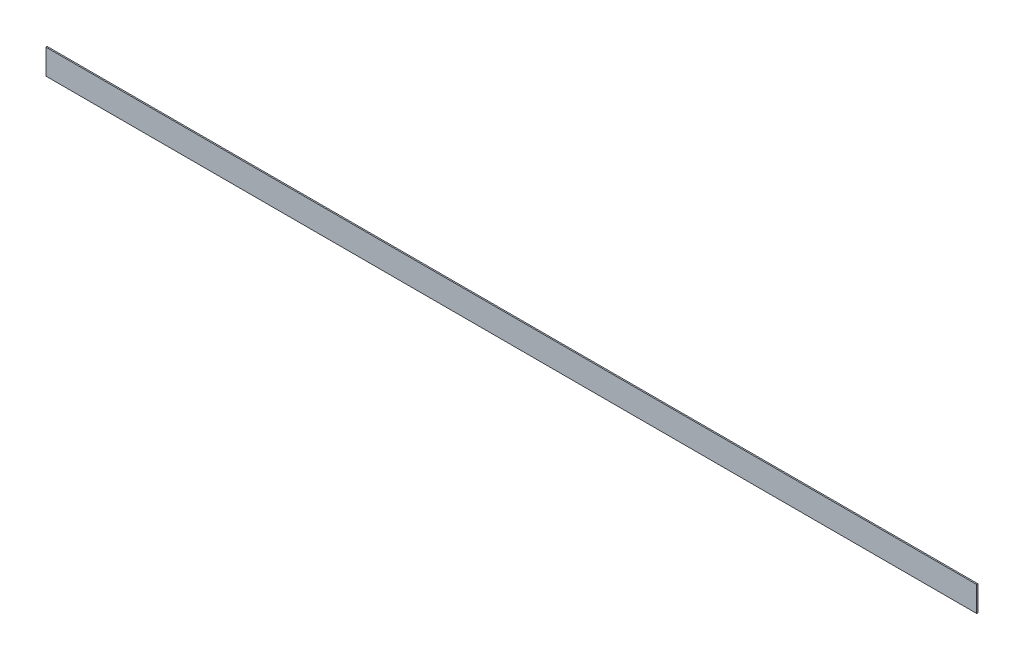
from build123d import *

# Parameters (mm, degrees)
SKETCH2_W           = 740
SKETCH2_H           = 20
BOSS_EXTRUDE1_DEPTH = 1


with BuildPart() as part:
    # Sketch2 → Boss-Extrude1 (new body)
    with BuildSketch(Plane.XY):
        Rectangle(SKETCH2_W, SKETCH2_H)
    extrude(amount=BOSS_EXTRUDE1_DEPTH)


solid = part.part
